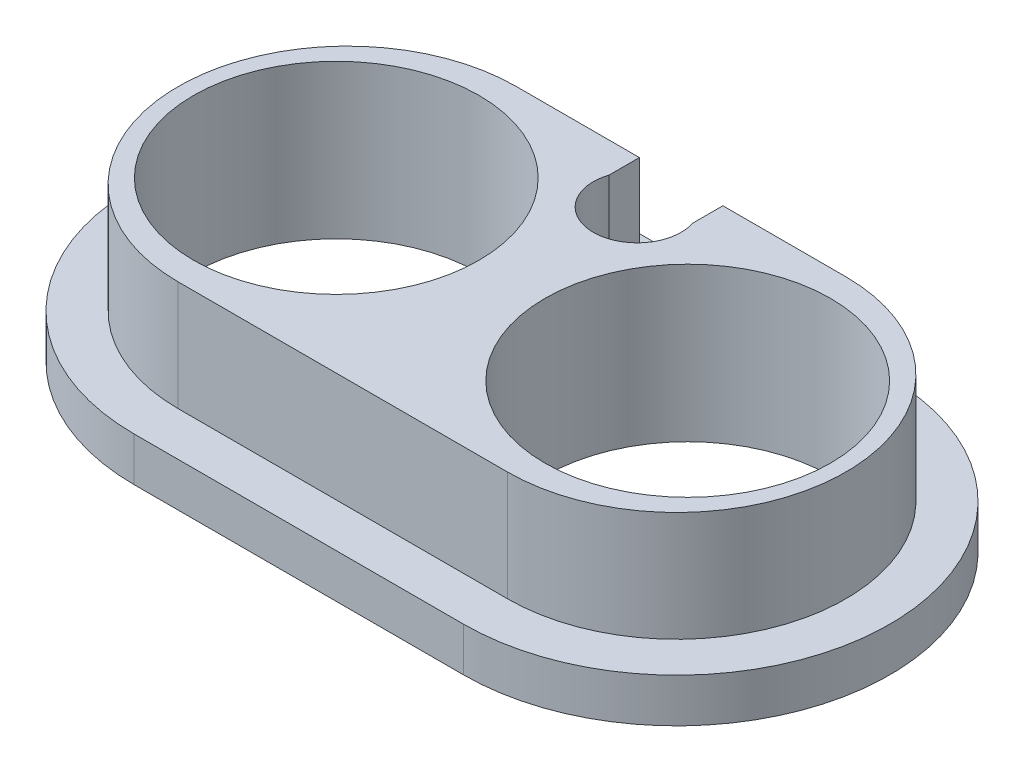
from build123d import *

# Parameters (mm, degrees)
EXTRUDE_1_DEPTH     = 2
EXTRUDE_2_DEPTH     = 5
CUT_EXTRUDE_1_REACH = 22.951
SKETCH_3_R          = 6.5


with BuildPart() as part:
    # 草圖2 → 填料-伸長1 (new body)
    with BuildSketch(Plane(origin=(0, 0, 0), x_dir=(1, 0, 0), z_dir=(0, 1, 0))):
        with BuildLine():
            Line((-7.5, 9.7), (7.5, 9.7))
            ThreePointArc((7.5, 9.7), (17.2, 0), (7.5, -9.7))
            Line((7.5, -9.7), (-7.5, -9.7))
            ThreePointArc((-7.5, -9.7), (-17.2, 0), (-7.5, 9.7))
        make_face()
    extrude(amount=-EXTRUDE_1_DEPTH)

    # 草圖1 → 填料-伸長2 (add)
    with BuildSketch(Plane(origin=(0, 0, 0), x_dir=(1, 0, 0), z_dir=(0, 1, 0))):
        with BuildLine():
            Line((-7.5, 7.7), (7.5, 7.7))
            ThreePointArc((7.5, 7.7), (15.2, 0), (7.5, -7.7))
            Line((7.5, -7.7), (-7.5, -7.7))
            ThreePointArc((-7.5, -7.7), (-15.2, 0), (-7.5, 7.7))
        make_face()
    extrude(amount=EXTRUDE_2_DEPTH)

    # 草圖3 → 除料-伸長1 (cut, up to next)
    with BuildSketch(Plane.XZ.offset(2), mode=Mode.PRIVATE) as cut_extrude_1_sk1:
        with Locations(Location((-8, 0, 0), (0, 0, 270))):
            Circle(SKETCH_3_R)
    cut_extrude_1_tool1 = extrude(cut_extrude_1_sk1.sketch, amount=-CUT_EXTRUDE_1_REACH, mode=Mode.PRIVATE) & part.part
    # 草圖3 → 除料-伸長1 (cut, up to next)
    with BuildSketch(Plane.XZ.offset(2), mode=Mode.PRIVATE) as cut_extrude_1_sk2:
        with Locations(Location((8, 0, 0), (0, 0, 270))):
            Circle(SKETCH_3_R)
    cut_extrude_1_tool2 = extrude(cut_extrude_1_sk2.sketch, amount=-CUT_EXTRUDE_1_REACH, mode=Mode.PRIVATE) & part.part
    # 草圖3 → 除料-伸長1 (cut, up to next)
    with BuildSketch(Plane.XZ.offset(2), mode=Mode.PRIVATE) as cut_extrude_1_sk3:
        with BuildLine():
            ThreePointArc((2, -5.7), (0, -3.7), (-2, -5.7))
            Line((-2, -5.7), (2, -5.7))
        make_face()
    cut_extrude_1_tool3 = extrude(cut_extrude_1_sk3.sketch, amount=-CUT_EXTRUDE_1_REACH, mode=Mode.PRIVATE) & part.part
    # 草圖3 → 除料-伸長1 (cut, up to next)
    with BuildSketch(Plane.XZ.offset(2), mode=Mode.PRIVATE) as cut_extrude_1_sk4:
        with BuildLine():
            Line((2, -5.7), (-2, -5.7))
            ThreePointArc((-2, -5.7), (-1.974841766, -6.016227766), (-1.9, -6.3244998))
            Line((-1.9, -6.3244998), (-1.9, -9.7))
            Line((-1.9, -9.7), (1.9, -9.7))
            Line((1.9, -9.7), (1.9, -6.3244998))
            ThreePointArc((1.9, -6.3244998), (1.974841766, -6.016227766), (2, -5.7))
        make_face()
    cut_extrude_1_tool4 = extrude(cut_extrude_1_sk4.sketch, amount=-CUT_EXTRUDE_1_REACH, mode=Mode.PRIVATE) & part.part
    add(cut_extrude_1_tool1.solids().sort_by_distance((-8, -2, 0))[0], mode=Mode.SUBTRACT)
    add(cut_extrude_1_tool2.solids().sort_by_distance((8, -2, 0))[0], mode=Mode.SUBTRACT)
    add(cut_extrude_1_tool3.solids().sort_by_distance((0, -2, -4.851174))[0], mode=Mode.SUBTRACT)
    add(cut_extrude_1_tool4.solids().sort_by_distance((0, -2, -7.690335))[0], mode=Mode.SUBTRACT)


solid = part.part
